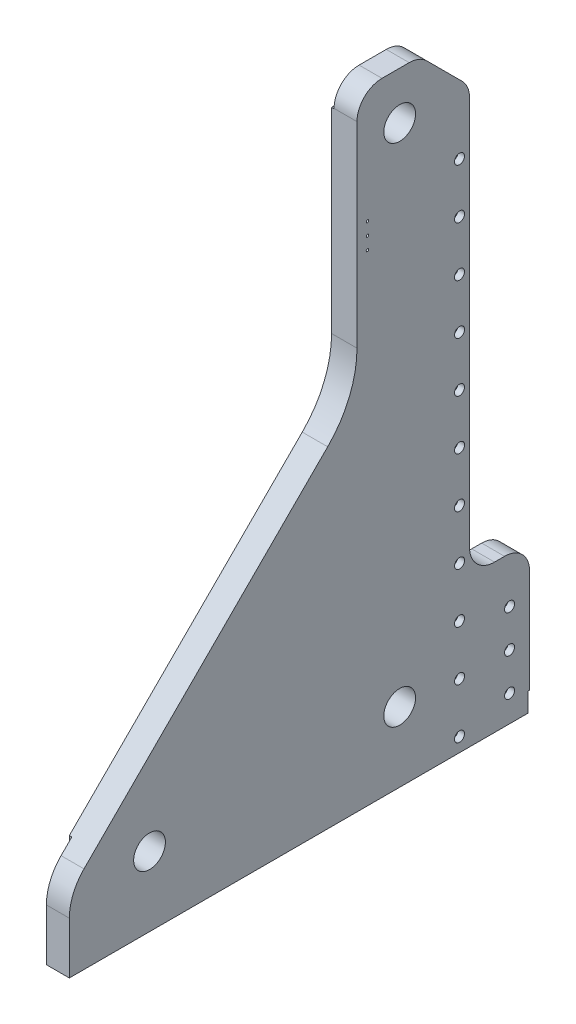
from build123d import *

# Parameters (mm, degrees)
BOSS_EXTRUDE1_DEPTH                                  = 50.8
SKETCH2_W                                            = 20
SKETCH2_H                                            = 55
CUT_EXTRUDE1_DEPTH                                   = 1485.951393144
SKETCH3_W                                            = 50.8
SKETCH3_H                                            = 5
CUT_EXTRUDE2_DEPTH                                   = 1553.894278436
SKETCH5_W                                            = 115
SKETCH5_H                                            = 323.205505282
CUT_EXTRUDE5_DEPTH                                   = 5
M6_TAPPED_HOLE1_D                                    = 5
M6_TAPPED_HOLE1_DEPTH                                = 20
M6_TAPPED_HOLE1_TIP                                  = 1.502151548
CBORE_FOR_M12_HEX_SOCKET_HEAD_CAP_SCREW1_D           = 13.5
CBORE_FOR_M12_HEX_SOCKET_HEAD_CAP_SCREW1_CBORE_D     = 20
CBORE_FOR_M12_HEX_SOCKET_HEAD_CAP_SCREW1_CBORE_DEPTH = 13
M12_TAPPED_HOLE1_D                                   = 10.2
M12_TAPPED_HOLE1_DEPTH                               = 43.99
M12_TAPPED_HOLE1_TIP                                 = 3.064389157
FILLET1_R                                            = 0.79375
SKETCH14_W                                           = 225
SKETCH14_H                                           = 50.8
SKETCH14_W_2                                         = 50.8
SKETCH14_H_2                                         = 195.8
CUT_EXTRUDE6_DEPTH                                   = 1485.788752654
SKETCH15_R                                           = 31.75
SKETCH15_W                                           = 3.175
SKETCH15_H                                           = 38.1
CUT_EXTRUDE7_DEPTH                                   = 1485.951393147
SKETCH16_R                                           = 31.75
CUT_EXTRUDE8_DEPTH                                   = 1485.951393144


with BuildPart() as part:
    # Sketch1 → Boss-Extrude1 (new body)
    with BuildSketch(Plane(origin=(0, 0, 0), x_dir=(0, 0, -1), z_dir=(1, 0, 0))):
        with BuildLine():
            Line((0, 350), (0, 1129.289321881))
            ThreePointArc((0, 1129.289321881), (-3.806023374, 1148.4234935), (-14.644660941, 1164.644660941))
            Line((-14.644660941, 1164.644660941), (-85.355339059, 1235.355339059))
            ThreePointArc((-85.355339059, 1235.355339059), (-101.5765065, 1246.193976626), (-120.710678119, 1250))
            Line((-120.710678119, 1250), (-175, 1250))
            ThreePointArc((-175, 1250), (-210.355339059, 1235.355339059), (-225, 1200))
            Line((-225, 1200), (-225, 807.842712475))
            ThreePointArc((-225, 807.842712475), (-240.224093498, 731.306026002), (-283.578643763, 666.421356237))
            Line((-283.578643763, 666.421356237), (-770.710678119, 179.289321881))
            ThreePointArc((-770.710678119, 179.289321881), (-792.387953251, 146.846986999), (-800, 108.578643763))
            Line((-800, 108.578643763), (-800, 0))
            Line((-800, 0), (0, 0))
            Line((0, 0), (120, 0))
            Line((120, 0), (120, 250))
            ThreePointArc((120, 250), (105.355339059, 285.355339059), (70, 300))
            Line((70, 300), (50, 300))
            ThreePointArc((50, 300), (14.644660941, 314.644660941), (0, 350))
        make_face()
    extrude(amount=BOSS_EXTRUDE1_DEPTH)

    # Sketch2 → Cut-Extrude1 (cut, through all)
    with BuildSketch(Plane(origin=(0, 1250, 0), x_dir=(1, 0, 0), z_dir=(0, 1, 0))):
        with Locations((10, -22.5)):
            Rectangle(SKETCH2_W, SKETCH2_H)
    extrude(amount=-CUT_EXTRUDE1_DEPTH, mode=Mode.SUBTRACT)

    # Sketch3 → Cut-Extrude2 (cut, through all)
    with BuildSketch(Plane(origin=(0, 0, 800), x_dir=(-1, 0, 0), z_dir=(0, 0, -1))):
        with Locations((-25.4, 2.5)):
            Rectangle(SKETCH3_W, SKETCH3_H)
    extrude(amount=CUT_EXTRUDE2_DEPTH, mode=Mode.SUBTRACT)

    # Sketch5 → Cut-Extrude5 (cut)
    with BuildSketch(Plane(origin=(0, 0, 0), x_dir=(0, 0, -1), z_dir=(1, 0, 0))):
        with Locations((62.5, 166.602752641)):
            Rectangle(SKETCH5_W, SKETCH5_H)
    extrude(amount=CUT_EXTRUDE5_DEPTH, mode=Mode.SUBTRACT)

    # M6 Tapped Hole1
    with Locations(Plane(origin=(50.8, 0, 0), x_dir=(0, 0, -1), z_dir=(1, 0, 0))):
        with Locations((-204, 1017), (-204, 967), (-204, 992)):
            Hole(M6_TAPPED_HOLE1_D / 2, depth=M6_TAPPED_HOLE1_DEPTH)
            with Locations((0, 0, -(M6_TAPPED_HOLE1_DEPTH + M6_TAPPED_HOLE1_TIP / 2))):  # 118° drill point
                Cone(0, M6_TAPPED_HOLE1_D / 2, M6_TAPPED_HOLE1_TIP, mode=Mode.SUBTRACT)

    # CBORE for M12 Hex Socket Head Cap Screw1 (through all)
    with Locations(Plane(origin=(50.8, 0, 0), x_dir=(0, 0, -1), z_dir=(1, 0, 0))):
        with Locations((-20, 33), (-20, 133), (-20, 233), (-20, 333), (-20, 433), (-20, 533), (-20, 633), (-20, 733), (-20, 833), (-20, 933), (-20, 1033), (80, 58), (80, 133), (80, 208)):
            CounterBoreHole(CBORE_FOR_M12_HEX_SOCKET_HEAD_CAP_SCREW1_D / 2, CBORE_FOR_M12_HEX_SOCKET_HEAD_CAP_SCREW1_CBORE_D / 2, CBORE_FOR_M12_HEX_SOCKET_HEAD_CAP_SCREW1_CBORE_DEPTH)

    # M12 Tapped Hole1
    with Locations(Plane(origin=(0, 5, 0), x_dir=(-1, 0, 0), z_dir=(0, -1, 0))):
        with Locations((-25, -770), (-25, 90), (-25, 30), (-25, -60), (-25, -140), (-25, -220), (-25, -300), (-25, -380), (-25, -460), (-25, -540), (-25, -620), (-25, -710)):
            Hole(M12_TAPPED_HOLE1_D / 2, depth=M12_TAPPED_HOLE1_DEPTH)
            with Locations((0, 0, -(M12_TAPPED_HOLE1_DEPTH + M12_TAPPED_HOLE1_TIP / 2))):  # 118° drill point
                Cone(0, M12_TAPPED_HOLE1_D / 2, M12_TAPPED_HOLE1_TIP, mode=Mode.SUBTRACT)

    # Fillet1
    fillet1_edges = [part.edges().sort_by_distance(p)[0] for p in [
        (20, 602.5, 50),
        (20, 166.602752641, -5),
    ]]
    fillet(fillet1_edges, radius=FILLET1_R)

    # Sketch14 → Cut-Extrude6 (cut, through all)
    with BuildSketch(Plane.ZY.offset(-5)):
        with Locations((112.5, 1224.6)):
            Rectangle(SKETCH14_W, SKETCH14_H)
        with Locations((774.6, 102.9)):
            Rectangle(SKETCH14_W_2, SKETCH14_H_2)
    extrude(amount=CUT_EXTRUDE6_DEPTH, mode=Mode.SUBTRACT)

    # Sketch15 → Cut-Extrude7 (cut, through all)
    with BuildSketch(Plane.ZY):
        with Locations((139.6896, 144.2936)):
            Circle(SKETCH15_R)
        with Locations((-118.4125, 24.05)):
            Rectangle(SKETCH15_W, SKETCH15_H)
    extrude(amount=-CUT_EXTRUDE7_DEPTH, mode=Mode.SUBTRACT)

    # Sketch16 → Cut-Extrude8 (cut, through all)
    with BuildSketch(Plane(origin=(50.8, 0, 0), x_dir=(0, 0, -1), z_dir=(1, 0, 0))):
        with Locations((-139.6896, 1155)):
            Circle(SKETCH16_R)
        with Locations((-639.6896, 144.2936)):
            Circle(SKETCH16_R)
    extrude(amount=-CUT_EXTRUDE8_DEPTH, mode=Mode.SUBTRACT)


solid = part.part
